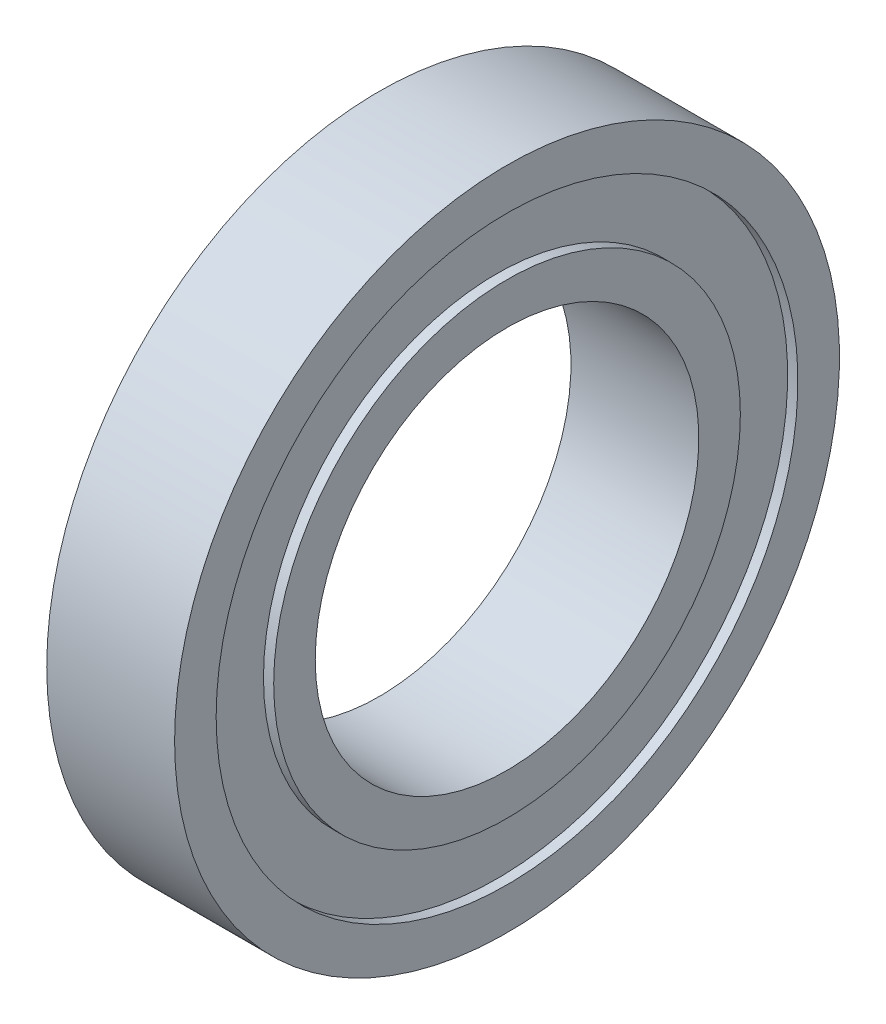
from build123d import *


with BuildPart() as part:
    # Sketch1 → Revolve1 (revolve)
    with BuildSketch(Plane(origin=(0, 0, 0), x_dir=(1, 0, 0), z_dir=(0, 1, 0)), mode=Mode.PRIVATE) as revolve1_sk:
        Polygon((0, 7.5), (0, 9.125), (0.4, 9.125), (0.4, 11.375), (0, 11.375), (0, 13), (5, 13), (5, 11.375), (4.6, 11.375), (4.6, 9.125), (5, 9.125), (5, 7.5), align=None)
    revolve(revolve1_sk.sketch.rotate(Axis((0, 0, 0), (1, 0, 0)), 180), axis=Axis((0, 0, 0), (1, 0, 0)))


solid = part.part
